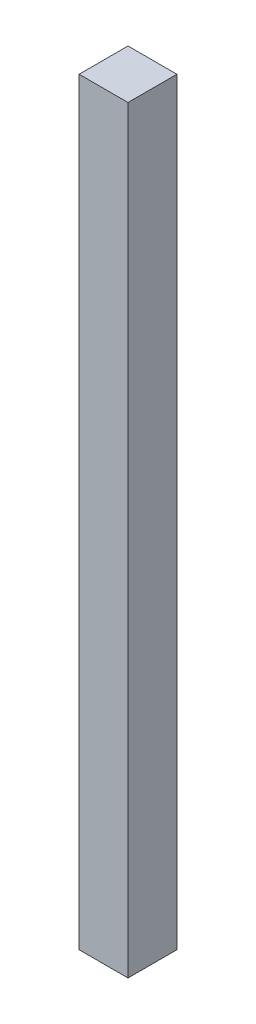
from build123d import *

# Parameters (mm, degrees)
SKETCH1_W           = 20
SKETCH1_H           = 20
BOSS_EXTRUDE1_DEPTH = 310


with BuildPart() as part:
    # Sketch1 → Boss-Extrude1 (new body)
    with BuildSketch(Plane(origin=(0, 0, 0), x_dir=(1, 0, 0), z_dir=(0, 1, 0))):
        with Locations((10, 10)):
            Rectangle(SKETCH1_W, SKETCH1_H)
    extrude(amount=BOSS_EXTRUDE1_DEPTH)


solid = part.part
